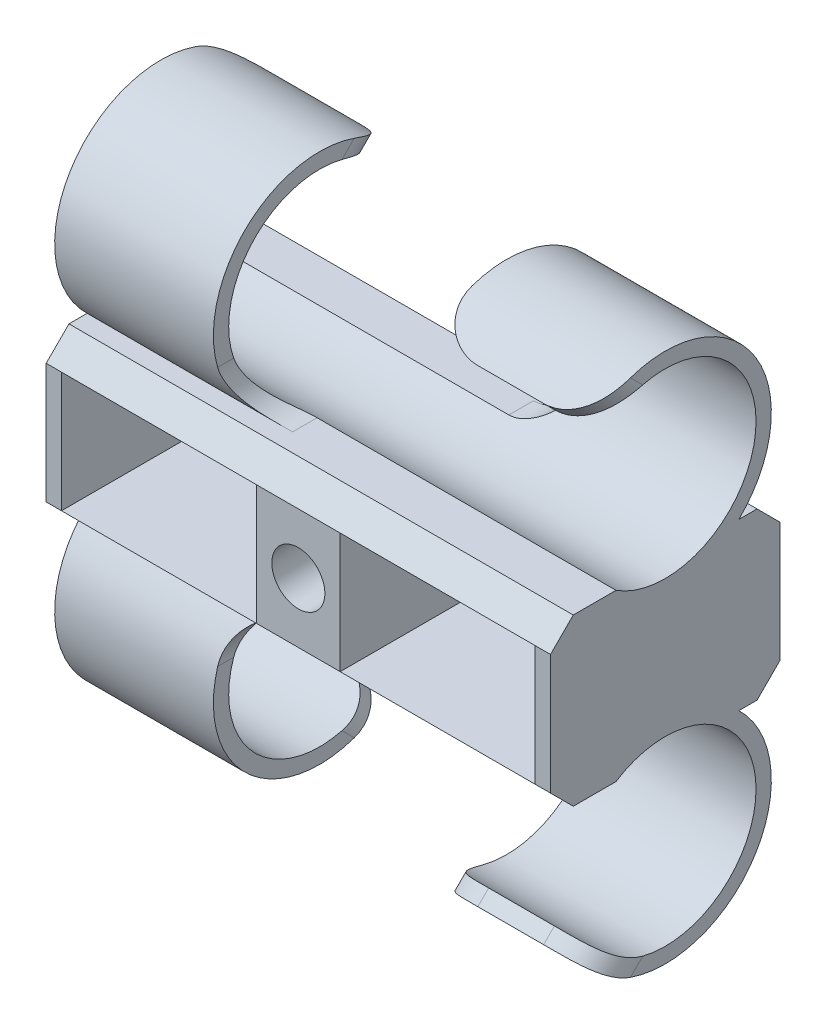
from build123d import *

# Parameters (mm, degrees)
SKETCH2_R               = 10.8712
BOSS_EXTRUDE2_DEPTH     = 30.1625
CUT_EXTRUDE1_DEPTH      = 11.176
CUT_EXTRUDE2_DEPTH      = 46.890822201
CIRPATTERN1_COUNT       = 2
FILLET1_R               = 5.55625
CUT_EXTRUDE3_DEPTH      = 46.890822336
CUT_EXTRUDE3_DEPTH_BACK = 46.890822336
SKETCH5_R               = 3.175
SKETCH7_W               = 23.3299
SKETCH7_H               = 14.3637
CUT_EXTRUDE5_DEPTH      = 23.7744
FILLET2_R               = 5.588


with BuildPart() as part:
    # Sketch2 → Boss-Extrude2 (new, symmetric)
    with BuildSketch(Plane(origin=(0, 0, 0), x_dir=(0, 0, -1), z_dir=(1, 0, 0))):
        with BuildLine():
            Line((-8.813470599, 9.906), (-10.99185, 9.906))
            Line((-10.99185, 9.906), (-13.716, 7.18185))
            Line((-13.716, 7.18185), (-13.716, 0))
            Line((-13.716, 0), (13.716, 0))
            Line((13.716, 0), (13.716, 7.18185))
            Line((13.716, 7.18185), (10.99185, 9.906))
            Line((10.99185, 9.906), (8.813470599, 9.906))
            ThreePointArc((8.813470599, 9.906), (0, 31.75), (-8.813470599, 9.906))
        make_face()
        with Locations(Location((0, 19.05, 0), (0, 0, 180))):
            Circle(SKETCH2_R, mode=Mode.SUBTRACT)
    extrude(amount=BOSS_EXTRUDE2_DEPTH, both=True)

    # Sketch3 → Cut-Extrude1 (cut, symmetric)
    with BuildSketch(Plane(origin=(0, 0, 0), x_dir=(0, 0, -1), z_dir=(1, 0, 0))):
        with BuildLine():
            Line((-8.813470599, 9.906), (-5.879647391, 9.906))
            ThreePointArc((-5.879647391, 9.906), (0, 29.9212), (5.879647391, 9.906))
            Line((5.879647391, 9.906), (8.813470599, 9.906))
            ThreePointArc((8.813470599, 9.906), (0, 31.75), (-8.813470599, 9.906))
        make_face()
    extrude(amount=CUT_EXTRUDE1_DEPTH, both=True, mode=Mode.SUBTRACT)

    # Sketch4 → Cut-Extrude2 (cut, through all)
    with BuildSketch(Plane(origin=(0, 0, 0), x_dir=(0, 0, -1), z_dir=(1, 0, 0))):
        with BuildLine():
            Line((-7.68709924, 26.73709924), (-8.980256121, 28.030256121))
            ThreePointArc((-8.980256121, 28.030256121), (-12.699462297, 18.933135262), (-8.813470599, 9.906))
            Line((-8.813470599, 9.906), (-5.879647391, 9.906))
            ThreePointArc((-5.879647391, 9.906), (-10.809053101, 17.889241411), (-7.68709924, 26.73709924))
        make_face()
    cut_extrude2 = extrude(amount=CUT_EXTRUDE2_DEPTH, mode=Mode.SUBTRACT)

    # CirPattern1: Cut-Extrude2 ×2 about axis
    cirpattern1_axis = Axis((0, 34.925, 0), (0, -1, 0))
    for i in range(1, CIRPATTERN1_COUNT):
        add(cut_extrude2.rotate(cirpattern1_axis, i * 360 / CIRPATTERN1_COUNT), mode=Mode.SUBTRACT)

    # Fillet1
    fillet1_edges = [part.edges().sort_by_distance(p)[0] for p in [
        (11.176, 27.38367768, 8.33367768),
        (30.1625, 27.38367768, 8.33367768),
        (-11.176, 27.38367768, -8.33367768),
        (-30.1625, 27.38367768, -8.33367768),
    ]]
    fillet(fillet1_edges, radius=FILLET1_R)

    # Mirror1: part across plane


with BuildPart() as part_1:
    add(part.part)
    add(part.part.mirror(Plane.ZX))

    # Sketch5 → Cut-Extrude3 (cut, two sides: drawn at the far end of the back side and taken through both)
    with BuildSketch(Plane(origin=(0, 0, 0), x_dir=(-1, 0, 0), z_dir=(0, 0, -1)).offset(-CUT_EXTRUDE3_DEPTH_BACK)):
        Circle(SKETCH5_R)
    extrude(amount=CUT_EXTRUDE3_DEPTH + CUT_EXTRUDE3_DEPTH_BACK, mode=Mode.SUBTRACT)

    # Cut-Extrude4 cone 1 section (through the dimple's axis) → Cut-Extrude4 (revolve, cut)
    with BuildSketch(Plane(origin=(0, 0, -13.716), x_dir=(0, 1, 0), z_dir=(1, 0, 0))):
        Polygon((0, 0), (6.223, 0), (0, 6.223), align=None)
    revolve(axis=Axis((0, 0, -13.716), (0, 0, 1)), mode=Mode.SUBTRACT)

    # Sketch7 → Cut-Extrude5 (cut)
    with BuildSketch(Plane.XY.offset(13.716)):
        with Locations((-16.66875, 0)):
            Rectangle(SKETCH7_W, SKETCH7_H)
        with Locations((16.66875, 0)):
            Rectangle(SKETCH7_W, SKETCH7_H)
    extrude(amount=-CUT_EXTRUDE5_DEPTH, mode=Mode.SUBTRACT)

    # Fillet2
    fillet2_edges = [part_1.edges().sort_by_distance(p)[0] for p in [
        (11.176, -9.906, -7.346558995),
        (-11.176, -9.906, 7.346558995),
        (-11.176, 9.906, 7.346558995),
        (11.176, 9.906, -7.346558995),
    ]]
    fillet(fillet2_edges, radius=FILLET2_R)


solid = part_1.part
